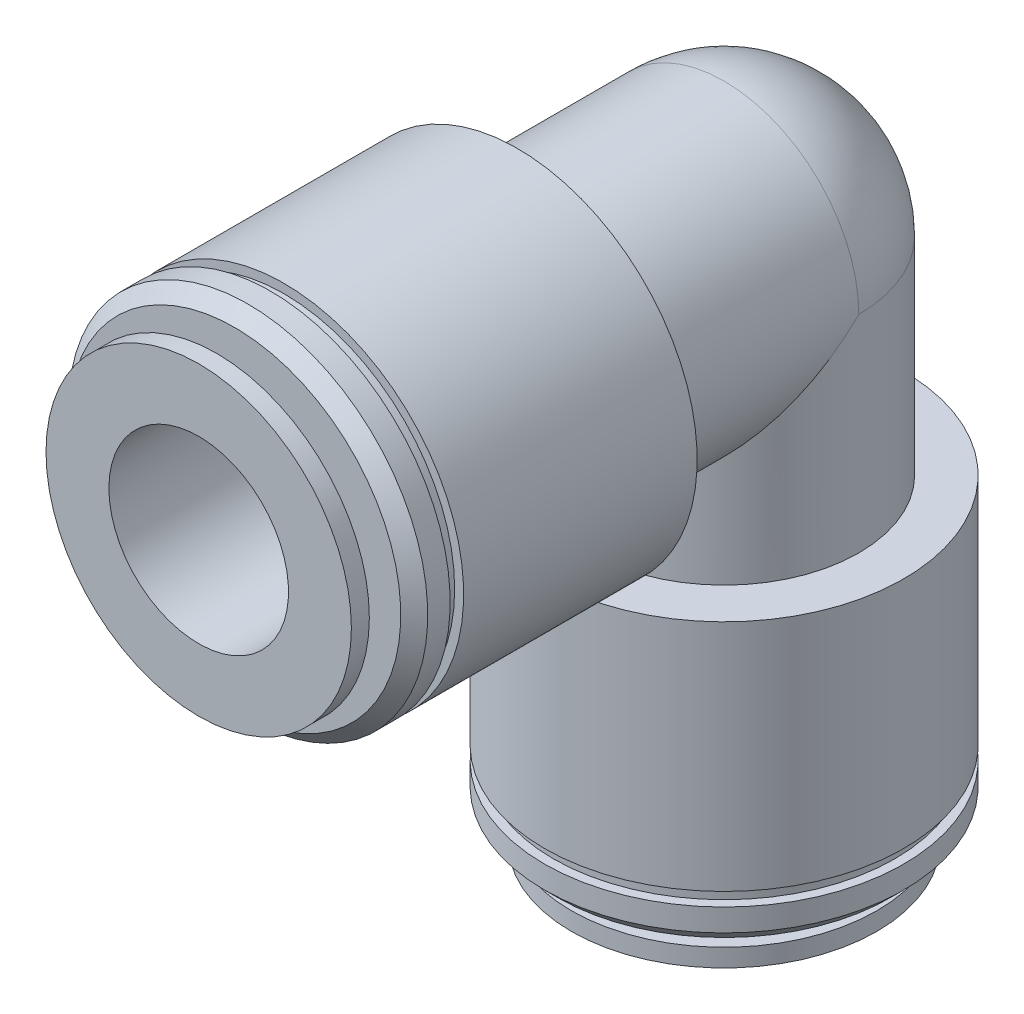
from build123d import *
from build123d.topology import SkipClean

# Parameters (mm, degrees)
SKETCH_3_R          = 7.5
EXTRUDE_2_DEPTH     = 11.5
SKETCH_4_R          = 10
EXTRUDE_3_DEPTH     = 13
EXTRUDE_START       = 4
SKETCH_7_R          = 7.5
EXTRUDE_4_DEPTH     = 4
SKETCH_8_R          = 10
EXTRUDE_6_DEPTH     = 13
SKETCH_10_R         = 5
CUT_EXTRUDE_1_DEPTH = 25
SKETCH_11_R         = 5
CUT_EXTRUDE_2_DEPTH = 21


with BuildPart() as part:
    # Эскиз2 → Повернуть1 (revolve)
    with BuildSketch(Plane.XY, mode=Mode.PRIVATE) as revolve_1_sk:
        with BuildLine():
            Line((0, 22.5), (0, 37.5))
            ThreePointArc((0, 37.5), (5.303300859, 35.303300859), (7.5, 30))
            Line((7.5, 30), (7.5, 22.5))
            Line((7.5, 22.5), (0, 22.5))
        make_face()
    revolve(revolve_1_sk.sketch.rotate(Axis((0, 22.5, 0), (0, 1, 0)), 90), axis=Axis((0, 22.5, 0), (0, 1, 0)))

    # Эскиз3 → Бобышка-Вытянуть2 (add)
    with SkipClean():  # the faces are left unmerged after this step: merging them gives an invalid solid
        with BuildSketch(Plane.XY):
            with Locations((0, 30)):
                Circle(SKETCH_3_R)
        extrude(amount=EXTRUDE_2_DEPTH)

    # Эскиз4 → Бобышка-Вытянуть3 (add)
    with SkipClean():  # the faces are left unmerged after this step: merging them gives an invalid solid
        with BuildSketch(Plane.XY.offset(11.5)):
            with Locations(Location((0, 30, 0), (0, 0, 180))):
                Circle(SKETCH_4_R)
        extrude(amount=EXTRUDE_3_DEPTH)

    # Эскиз7 → Бобышка-Вытянуть4 (add)
    with BuildSketch(Plane.XZ.offset(-22.5).offset(EXTRUDE_START)):
        with Locations(Location((0, 0, 0), (0, 0, 270))):
            Circle(SKETCH_7_R)
    extrude(amount=-EXTRUDE_4_DEPTH)

    # Эскиз8 → Бобышка-Вытянуть6 (add)
    with BuildSketch(Plane.XZ.offset(-18.5)):
        with Locations(Location((0, 0, 0), (0, 0, 90))):
            Circle(SKETCH_8_R)
    extrude(amount=EXTRUDE_6_DEPTH)

    # Эскиз9 → Повернуть5 (revolve)
    with BuildSketch(Plane(origin=(0, 0, 0), x_dir=(0, 0, -1), z_dir=(1, 0, 0)), mode=Mode.PRIVATE) as revolve_5_sk:
        Polygon((8.5, 1.75), (6.5, 1.75), (6.5, 2.75), (9.25, 2.75), (10, 3.5), (10, 4.75), (9.5, 4.75), (9.5, 5.5), (5, 5.5), (5, 0.75), (8.5, 0.75), align=None)
    revolve(revolve_5_sk.sketch.rotate(Axis((0, 5.5, 0), (0, -1, 0)), 180), axis=Axis((0, 5.5, 0), (0, -1, 0)))

    # Эскиз14 → Повернуть6 (revolve)
    with BuildSketch(Plane(origin=(0, 0, 0), x_dir=(0, 0, -1), z_dir=(1, 0, 0)), mode=Mode.PRIVATE) as revolve_6_sk:
        Polygon((-28.25, 21.5), (-28.25, 23.5), (-27.25, 23.5), (-27.25, 20.75), (-26.5, 20), (-25.25, 20), (-25.25, 20.5), (-24.5, 20.5), (-24.5, 25), (-29.25, 25), (-29.25, 21.5), align=None)
    revolve(revolve_6_sk.sketch.rotate(Axis((0, 30, 24.5), (0, 0, 1)), 270), axis=Axis((0, 30, 24.5), (0, 0, 1)))

    # Эскиз10 → Вырез-Вытянуть1 (cut)
    with BuildSketch(Plane.XZ.offset(-5.5)):
        with Locations(Location((0, 0, 0), (0, 0, 90))):
            Circle(SKETCH_10_R)
    extrude(amount=-CUT_EXTRUDE_1_DEPTH, mode=Mode.SUBTRACT)

    # Эскиз11 → Вырез-Вытянуть2 (cut)
    with BuildSketch(Plane.XY.offset(24.5)):
        with Locations(Location((0, 30, 0), (0, 0, 180))):
            Circle(SKETCH_11_R)
    extrude(amount=-CUT_EXTRUDE_2_DEPTH, mode=Mode.SUBTRACT)


solid = part.part
